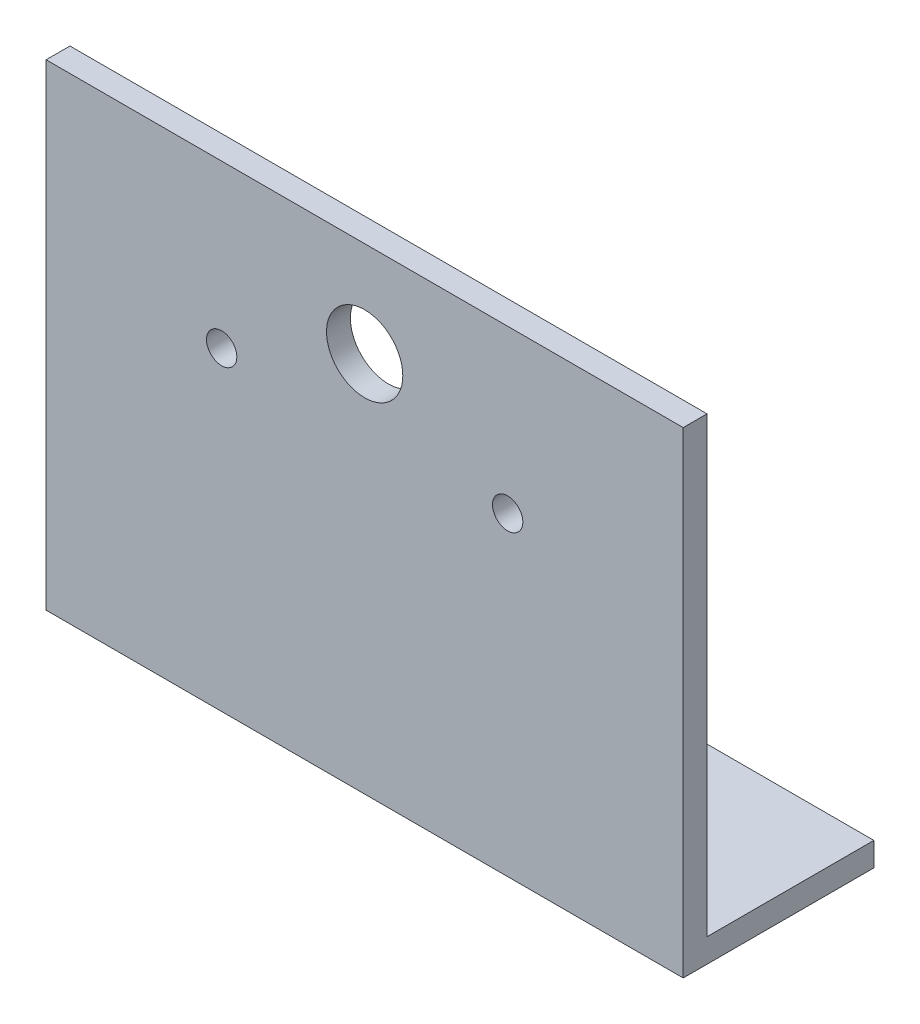
from build123d import *

# Parameters (mm, degrees)
SKETCH1_W                  = 84.86693599
SKETCH1_H                  = 63.5
SKETCH1_R                  = 5.08
BOSS_EXTRUDE1_DEPTH        = 3.175
F_10_32_TAPPED_HOLE1_D     = 4.0386
F_10_32_TAPPED_HOLE1_DEPTH = 11.938
F_10_32_TAPPED_HOLE1_TIP   = 1.213317848
F_10_32_TAPPED_HOLE2_D     = 4.0386
F_10_32_TAPPED_HOLE2_DEPTH = 11.938
F_10_32_TAPPED_HOLE2_TIP   = 1.213317848
SKETCH10_W                 = 84.86693599
SKETCH10_H                 = 3.175
BOSS_EXTRUDE2_DEPTH        = 22.225
F_10_32_TAPPED_HOLE3_D     = 4.0386
F_10_32_TAPPED_HOLE3_DEPTH = 11.938
F_10_32_TAPPED_HOLE3_TIP   = 1.213317848
F_10_32_TAPPED_HOLE4_D     = 4.0386
F_10_32_TAPPED_HOLE4_DEPTH = 11.938
F_10_32_TAPPED_HOLE4_TIP   = 1.213317848


with BuildPart() as part:
    # Sketch1 → Boss-Extrude1 (new body)
    with BuildSketch(Plane.XY):
        with Locations((0, -10.16)):
            Rectangle(SKETCH1_W, SKETCH1_H)
        with Locations((0, 8.89)):
            Circle(SKETCH1_R, mode=Mode.SUBTRACT)
    extrude(amount=BOSS_EXTRUDE1_DEPTH)

    # #10-32 Tapped Hole1
    with Locations(Plane.XY.offset(3.175)):
        with Locations((-19.05, 0)):
            Hole(F_10_32_TAPPED_HOLE1_D / 2, depth=F_10_32_TAPPED_HOLE1_DEPTH)
            with Locations((0, 0, -(F_10_32_TAPPED_HOLE1_DEPTH + F_10_32_TAPPED_HOLE1_TIP / 2))):  # 118° drill point
                Cone(0, F_10_32_TAPPED_HOLE1_D / 2, F_10_32_TAPPED_HOLE1_TIP, mode=Mode.SUBTRACT)

    # #10-32 Tapped Hole2
    with Locations(Plane.XY.offset(3.175)):
        with Locations((19.05, 0)):
            Hole(F_10_32_TAPPED_HOLE2_D / 2, depth=F_10_32_TAPPED_HOLE2_DEPTH)
            with Locations((0, 0, -(F_10_32_TAPPED_HOLE2_DEPTH + F_10_32_TAPPED_HOLE2_TIP / 2))):  # 118° drill point
                Cone(0, F_10_32_TAPPED_HOLE2_D / 2, F_10_32_TAPPED_HOLE2_TIP, mode=Mode.SUBTRACT)

    # Sketch10 → Boss-Extrude2 (add)
    with BuildSketch(Plane(origin=(0, 0, 0), x_dir=(-1, 0, 0), z_dir=(0, 0, -1))):
        with Locations((0, -40.3225)):
            Rectangle(SKETCH10_W, SKETCH10_H)
    extrude(amount=BOSS_EXTRUDE2_DEPTH)

    # #10-32 Tapped Hole3
    with Locations(Plane(origin=(0, -38.735, 0), x_dir=(-1, 0, 0), z_dir=(0, 1, 0))):
        with Locations((19.05, -17.78)):
            Hole(F_10_32_TAPPED_HOLE3_D / 2, depth=F_10_32_TAPPED_HOLE3_DEPTH)
            with Locations((0, 0, -(F_10_32_TAPPED_HOLE3_DEPTH + F_10_32_TAPPED_HOLE3_TIP / 2))):  # 118° drill point
                Cone(0, F_10_32_TAPPED_HOLE3_D / 2, F_10_32_TAPPED_HOLE3_TIP, mode=Mode.SUBTRACT)

    # #10-32 Tapped Hole4
    with Locations(Plane(origin=(0, -38.735, 0), x_dir=(-1, 0, 0), z_dir=(0, 1, 0))):
        with Locations((-19.05, -17.78)):
            Hole(F_10_32_TAPPED_HOLE4_D / 2, depth=F_10_32_TAPPED_HOLE4_DEPTH)
            with Locations((0, 0, -(F_10_32_TAPPED_HOLE4_DEPTH + F_10_32_TAPPED_HOLE4_TIP / 2))):  # 118° drill point
                Cone(0, F_10_32_TAPPED_HOLE4_D / 2, F_10_32_TAPPED_HOLE4_TIP, mode=Mode.SUBTRACT)


solid = part.part
